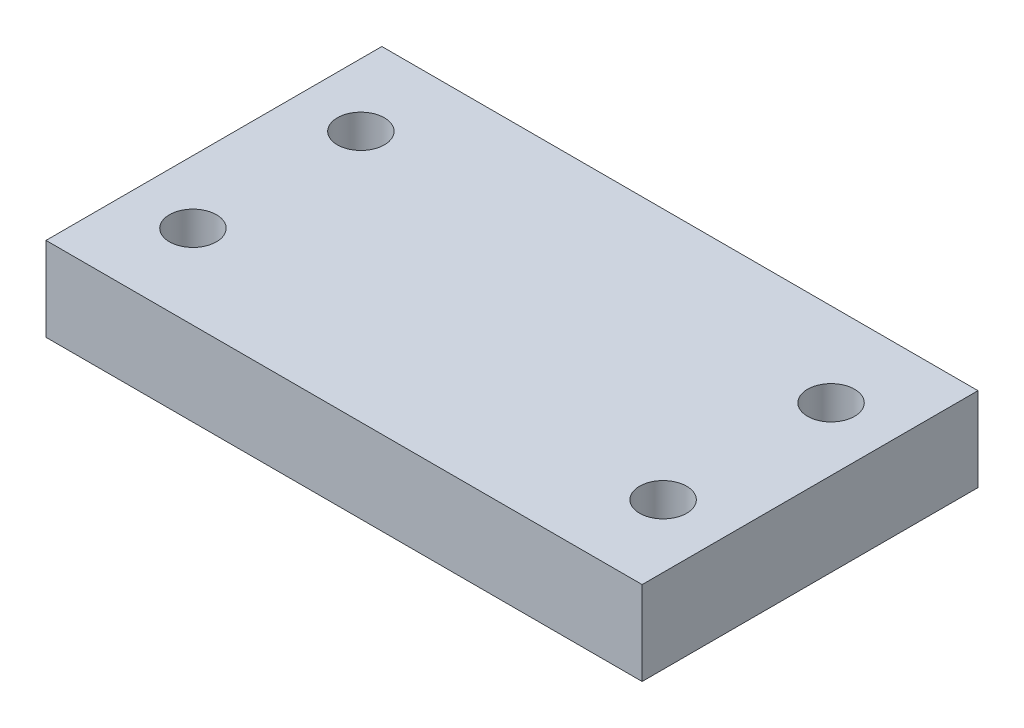
from build123d import *

# Parameters (mm, degrees)
SKETCH1_R           = 2.8
BOSS_EXTRUDE1_DEPTH = 10


with BuildPart() as part:
    # Sketch1 → Boss-Extrude1 (new body)
    with BuildSketch(Plane(origin=(0, 0, 0), x_dir=(1, 0, 0), z_dir=(0, 1, 0))):
        Polygon((-35.5, -10), (-35.5, 10), (-35.5, 30), (35.5, 30), (35.5, 10), (35.5, -10), align=None)
        with Locations(Location((28, 0, 0), (0, 0, 270))):
            Circle(SKETCH1_R, mode=Mode.SUBTRACT)
        with Locations(Location((-28, 0, 0), (0, 0, 90))):
            Circle(SKETCH1_R, mode=Mode.SUBTRACT)
        with Locations(Location((-28, 20, 0), (0, 0, 90))):
            Circle(SKETCH1_R, mode=Mode.SUBTRACT)
        with Locations(Location((28, 20, 0), (0, 0, 270))):
            Circle(SKETCH1_R, mode=Mode.SUBTRACT)
    extrude(amount=BOSS_EXTRUDE1_DEPTH)


solid = part.part
